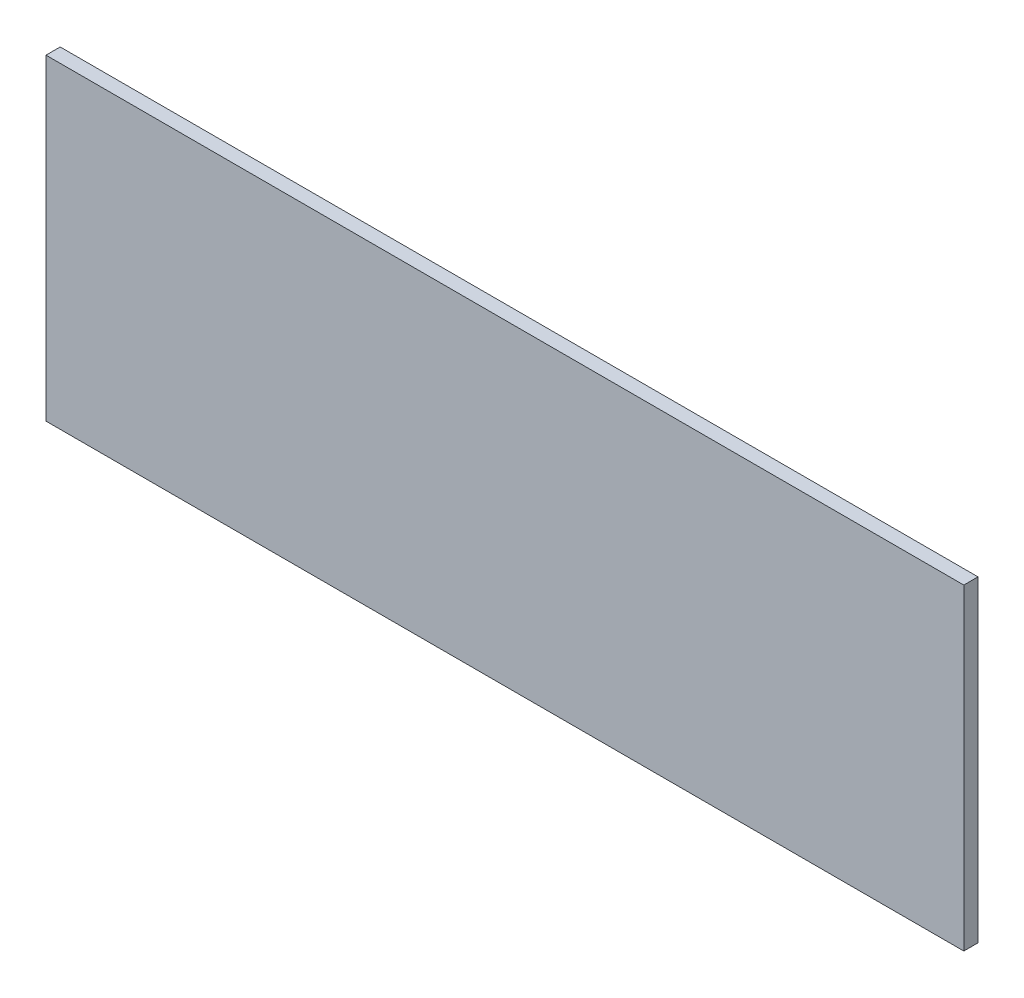
from build123d import *

# Parameters (mm, degrees)
SKETCH1_W     = 194
SKETCH1_H     = 67
PROFILE_DEPTH = 3


with BuildPart() as part:
    # Sketch1 → Profile (new body)
    with BuildSketch(Plane.XY):
        with Locations((97, 33.5)):
            Rectangle(SKETCH1_W, SKETCH1_H)
    extrude(amount=PROFILE_DEPTH)


solid = part.part
